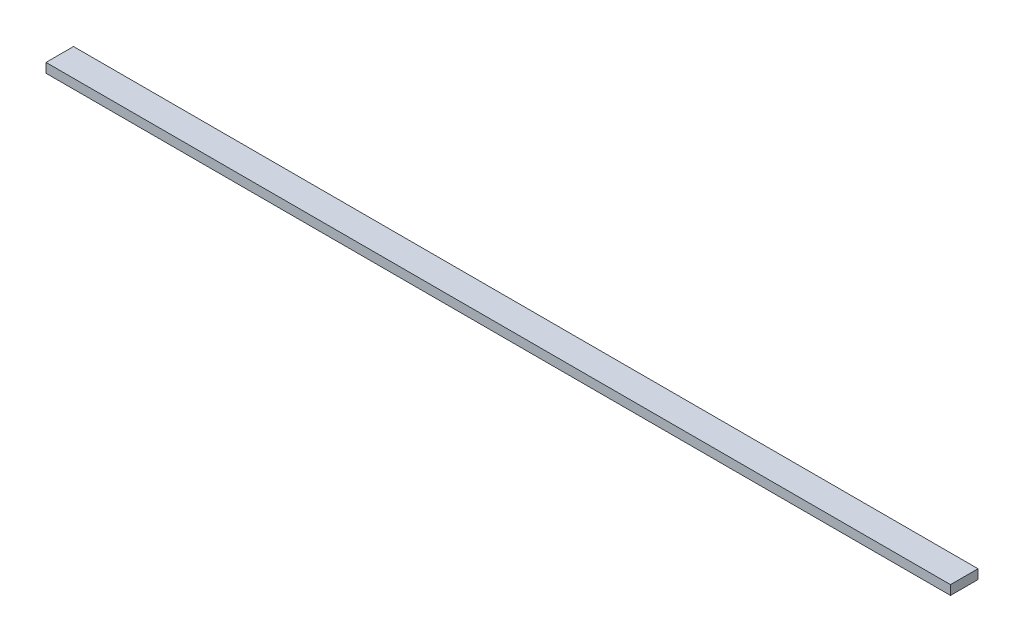
from build123d import *

# Parameters (mm, degrees)
SKETCH1_W           = 609.6
SKETCH1_H           = 18.542
BOSS_EXTRUDE1_DEPTH = 6.35


with BuildPart() as part:
    # Sketch1 → Boss-Extrude1 (new body)
    with BuildSketch(Plane(origin=(0, 0, 0), x_dir=(1, 0, 0), z_dir=(0, 1, 0))):
        Rectangle(SKETCH1_W, SKETCH1_H)
    extrude(amount=BOSS_EXTRUDE1_DEPTH)


solid = part.part
